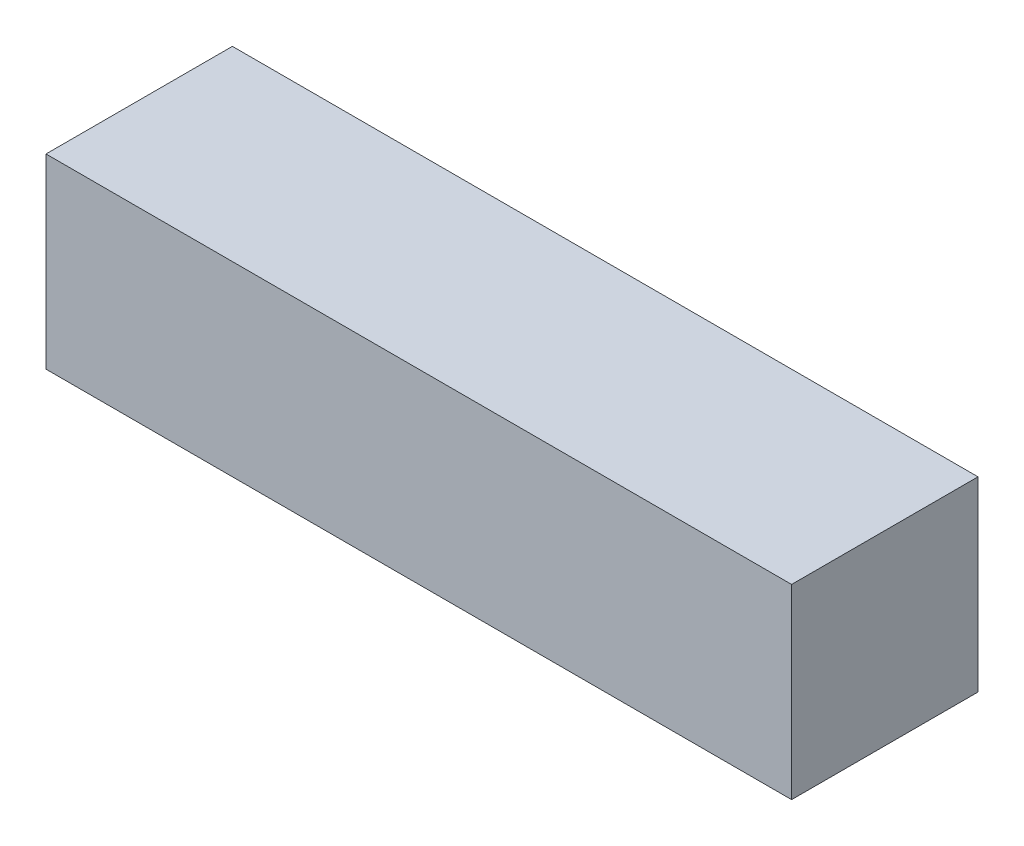
from build123d import *

# Parameters (mm, degrees)
CROQUIS1_W              = 160
CROQUIS1_H              = 40
SALIENTE_EXTRUIR1_DEPTH = 40


with BuildPart() as part:
    # Croquis1 → Saliente-Extruir1 (new body)
    with BuildSketch(Plane(origin=(0, 0, 0), x_dir=(1, 0, 0), z_dir=(0, 1, 0))):
        Rectangle(CROQUIS1_W, CROQUIS1_H)
    extrude(amount=SALIENTE_EXTRUIR1_DEPTH)


solid = part.part
